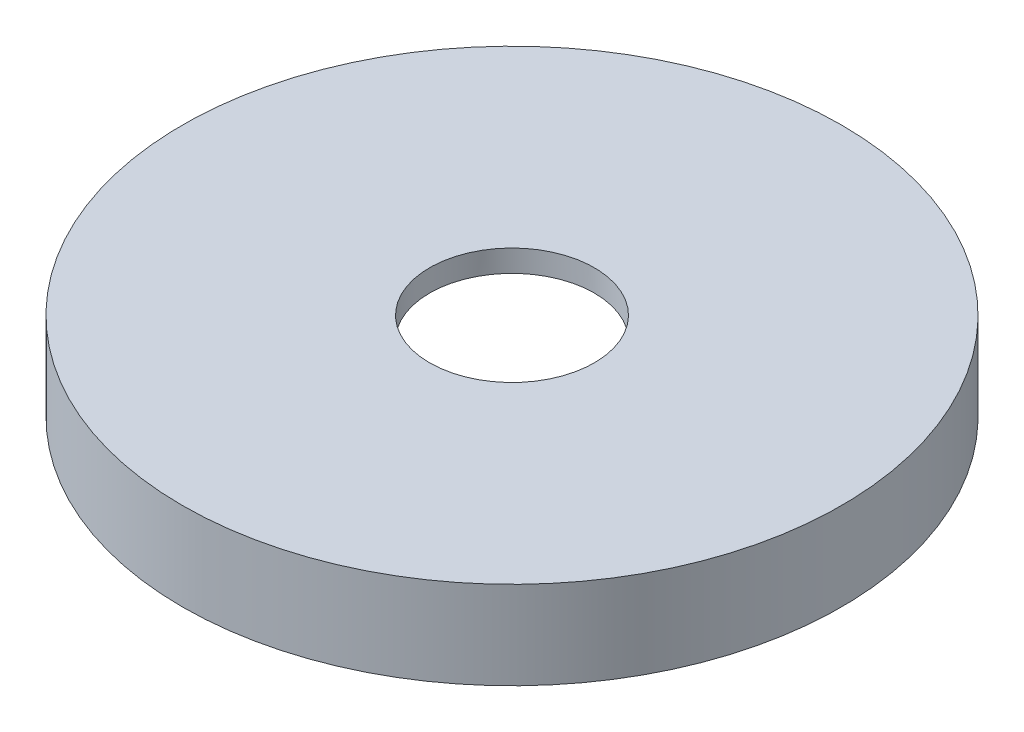
from build123d import *

# Parameters (mm, degrees)
ESQUISSE1_R             = 30
BOSS_EXTRU_1_DEPTH      = 8
ESQUISSE2_R             = 17.5
ENL_V_MAT_EXTRU_1_DEPTH = 6
ESQUISSE3_R             = 7.5
ENL_V_MAT_EXTRU_2_DEPTH = 44.17406629


with BuildPart() as part:
    # Esquisse1 → Boss.-Extru.1 (new body)
    with BuildSketch(Plane(origin=(0, 0, 0), x_dir=(1, 0, 0), z_dir=(0, 1, 0))):
        with Locations(Location((0, 0, 0), (0, 0, 270))):
            Circle(ESQUISSE1_R)
    extrude(amount=BOSS_EXTRU_1_DEPTH)

    # Esquisse2 → Enlèv. mat.-Extru.1 (cut)
    with BuildSketch(Plane.XZ):
        with Locations(Location((0, 0, 0), (0, 0, 270))):
            Circle(ESQUISSE2_R)
    extrude(amount=-ENL_V_MAT_EXTRU_1_DEPTH, mode=Mode.SUBTRACT)

    # Esquisse3 → Enlèv. mat.-Extru.2 (cut, through all)
    with BuildSketch(Plane(origin=(0, 8, 0), x_dir=(1, 0, 0), z_dir=(0, 1, 0))):
        with Locations(Location((0, 0, 0), (0, 0, 270))):
            Circle(ESQUISSE3_R)
    extrude(amount=-ENL_V_MAT_EXTRU_2_DEPTH, mode=Mode.SUBTRACT)


solid = part.part
